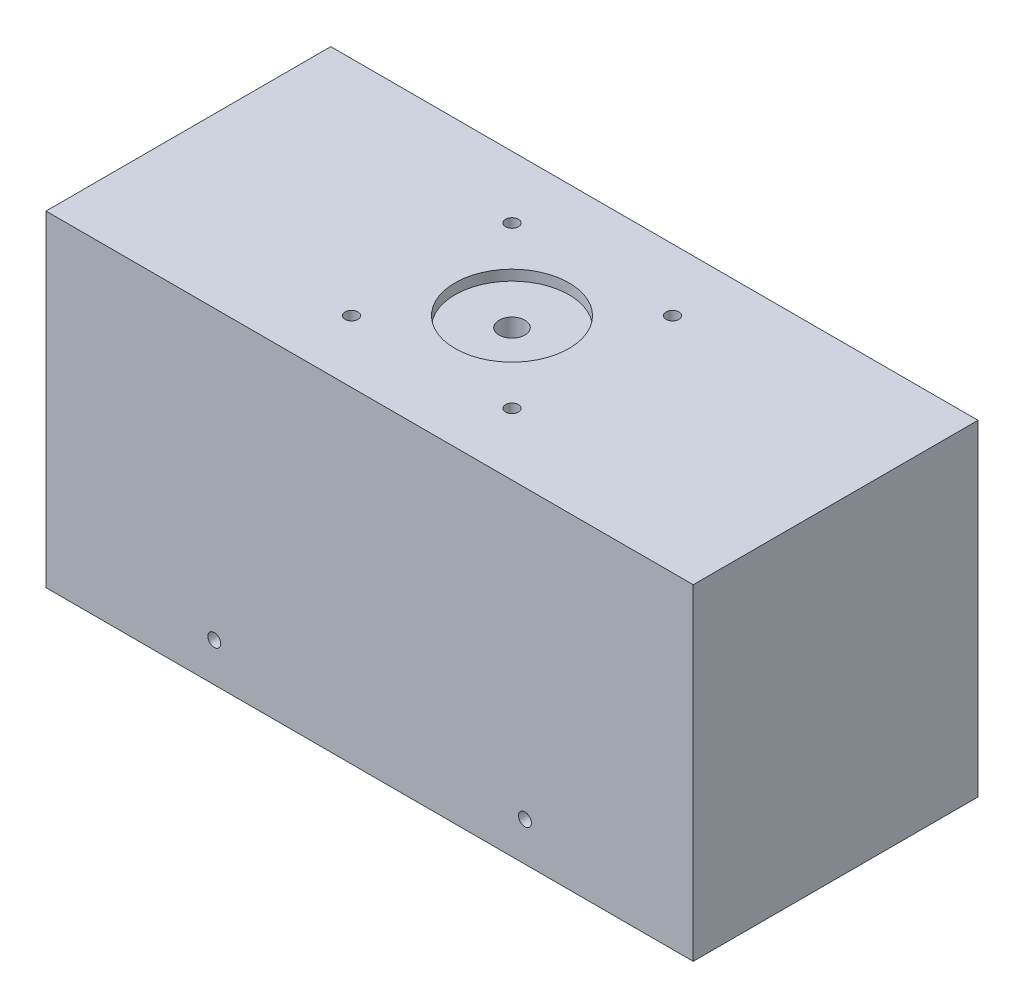
from build123d import *

# Parameters (mm, degrees)
SKETCH_1_W             = 125
SKETCH_1_H             = 55
EXTRUDE_1_DEPTH        = 6
SKETCH_2_R             = 11
CUT_EXTRUDE_1_DEPTH    = 2
CUT_EXTRUDE_2_REACH    = 70.4
SKETCH_3_R             = 2.5
HOLE_WIZARD_M3_1_D     = 2.5
HOLE_WIZARD_M3_1_DEPTH = 7.5
HOLE_WIZARD_M3_1_TIP   = 0.751075774
SKETCH_6_W             = 125
SKETCH_6_H             = 55
SKETCH_6_W_2           = 120
SKETCH_6_H_2           = 50
EXTRUDE_2_DEPTH        = 57
HOLE_WIZARD_M3_2_D     = 2.5
HOLE_WIZARD_M3_2_DEPTH = 2.5
HOLE_WIZARD_M3_3_D     = 2.5


with BuildPart() as part:
    # 草图1 → 凸台-拉伸1 (new body)
    with BuildSketch(Plane(origin=(0, 0, 0), x_dir=(1, 0, 0), z_dir=(0, 1, 0))):
        Rectangle(SKETCH_1_W, SKETCH_1_H)
    extrude(amount=EXTRUDE_1_DEPTH)

    # 草图2 → 切除-拉伸1 (cut)
    with BuildSketch(Plane(origin=(0, 6, 0), x_dir=(1, 0, 0), z_dir=(0, 1, 0))):
        with Locations(Location((0, 0, 0), (0, 0, 270))):
            Circle(SKETCH_2_R)
    extrude(amount=-CUT_EXTRUDE_1_DEPTH, mode=Mode.SUBTRACT)

    # 草图3 → 切除-拉伸2 (cut, up to next)
    with BuildSketch(Plane(origin=(0, 4, 0), x_dir=(1, 0, 0), z_dir=(0, 1, 0)), mode=Mode.PRIVATE) as cut_extrude_2_sk1:
        with Locations(Location((0, 0, 0), (0, 0, 270))):
            Circle(SKETCH_3_R)
    cut_extrude_2_tool1 = extrude(cut_extrude_2_sk1.sketch, amount=-CUT_EXTRUDE_2_REACH, mode=Mode.PRIVATE) & part.part
    add(cut_extrude_2_tool1.solids().sort_by_distance((0, 4, 0))[0], mode=Mode.SUBTRACT)

    # M3 螺纹孔1
    with Locations(Plane(origin=(0, 6, 0), x_dir=(1, 0, 0), z_dir=(0, 1, 0))):
        with Locations((15.5, 15.5), (15.5, -15.5), (-15.5, -15.5), (-15.5, 15.5)):
            Hole(HOLE_WIZARD_M3_1_D / 2, depth=HOLE_WIZARD_M3_1_DEPTH)
            with Locations((0, 0, -(HOLE_WIZARD_M3_1_DEPTH + HOLE_WIZARD_M3_1_TIP / 2))):  # 118° drill point
                Cone(0, HOLE_WIZARD_M3_1_D / 2, HOLE_WIZARD_M3_1_TIP, mode=Mode.SUBTRACT)

    # 草图6 → 凸台-拉伸2 (add)
    with BuildSketch(Plane.XZ):
        Rectangle(SKETCH_6_W, SKETCH_6_H)
        Rectangle(SKETCH_6_W_2, SKETCH_6_H_2, mode=Mode.SUBTRACT)
    extrude(amount=EXTRUDE_2_DEPTH)

    # M3 螺纹孔2
    with Locations(Plane(origin=(0, 0, -27.5), x_dir=(-1, 0, 0), z_dir=(0, 0, -1))):
        with Locations((30, -49.5), (-30, -49.5)):
            Hole(HOLE_WIZARD_M3_2_D / 2, depth=HOLE_WIZARD_M3_2_DEPTH)

    # M3 螺纹孔3 (through all)
    with Locations(Plane.XY.offset(27.5)):
        with Locations((30, -49.5), (-30, -49.5)):
            Hole(HOLE_WIZARD_M3_3_D / 2)


solid = part.part
